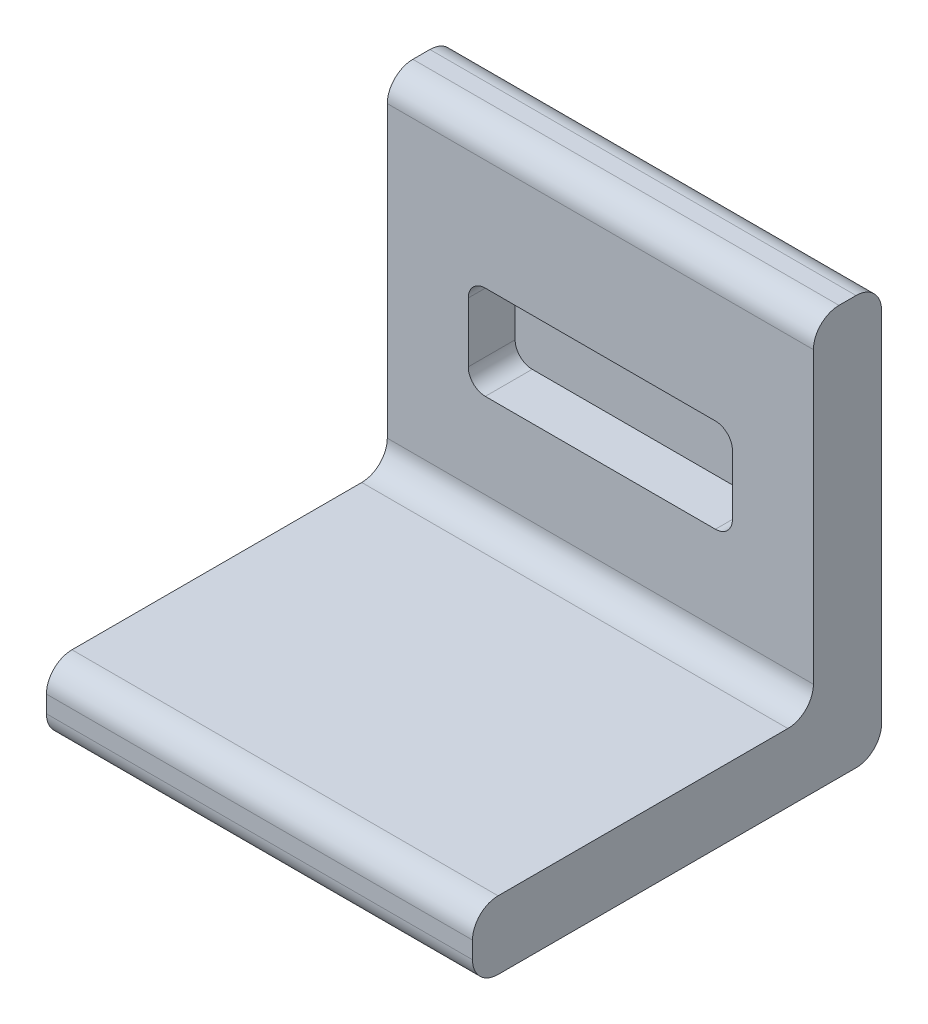
from build123d import *

# Parameters (mm, degrees)
SKETCH1_W           = 50
SKETCH1_H           = 40
BOSS_EXTRUDE1_DEPTH = 8
SKETCH2_W           = 50
SKETCH2_H           = 48
BOSS_EXTRUDE2_DEPTH = 8
SKETCH3_W           = 31
SKETCH3_H           = 11
CUT_EXTRUDE1_DEPTH  = 5.5
FILLET1_R           = 2
FILLET2_R           = 3


with BuildPart() as part:
    # Sketch1 → Boss-Extrude1 (new body)
    with BuildSketch(Plane(origin=(0, 0, 0), x_dir=(1, 0, 0), z_dir=(0, 1, 0))):
        with Locations((0, 20)):
            Rectangle(SKETCH1_W, SKETCH1_H)
    extrude(amount=BOSS_EXTRUDE1_DEPTH)

    # Sketch2 → Boss-Extrude2 (add)
    with BuildSketch(Plane(origin=(0, 0, -40), x_dir=(-1, 0, 0), z_dir=(0, 0, -1))):
        with Locations((0, 24)):
            Rectangle(SKETCH2_W, SKETCH2_H)
    extrude(amount=BOSS_EXTRUDE2_DEPTH)

    # Sketch3 → Cut-Extrude1 (cut)
    with BuildSketch(Plane.XY.offset(-40)):
        with Locations((0, 26.5)):
            Rectangle(SKETCH3_W, SKETCH3_H)
    extrude(amount=-CUT_EXTRUDE1_DEPTH, mode=Mode.SUBTRACT)

    # Fillet1
    fillet1_edges = [part.edges().sort_by_distance(p)[0] for p in [
        (-15.5, 21, -42.75),
        (-15.5, 32, -42.75),
        (15.5, 32, -42.75),
        (15.5, 21, -42.75),
    ]]
    fillet(fillet1_edges, radius=FILLET1_R)

    # Fillet2
    fillet2_edges = [part.edges().sort_by_distance(p)[0] for p in [
        (0, 48, -40),
        (0, 0, -48),
        (0, 8, -40),
        (0, 48, -48),
        (0, 0, 0),
        (0, 8, 0),
    ]]
    fillet(fillet2_edges, radius=FILLET2_R)


solid = part.part
